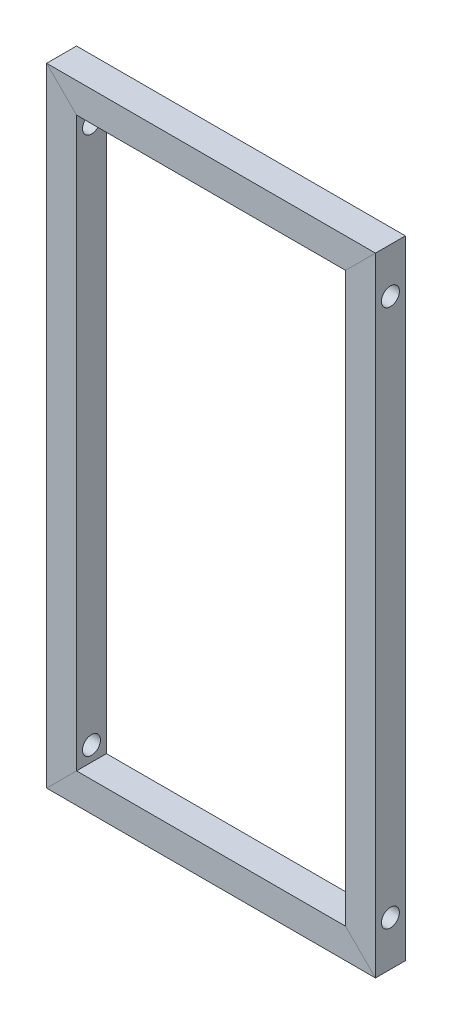
from build123d import *

# Parameters (mm, degrees)
SKETCH1_W          = 0.508
SKETCH1_H          = 0.508
SKETCH2_R          = 0.1524
CUT_EXTRUDE1_DEPTH = 12.821237499


with BuildPart() as part:
    # Sweep1: sweep along a curve in space
    with BuildLine() as sweep1_path:
        Line((0, 0, 0), (5.08, 0, 0))
        Line((5.08, 0, 0), (5.08, -10.16, 0))
        Line((5.08, -10.16, 0), (0, -10.16, 0))
        Line((0, -10.16, 0), (0, 0, 0))
    # Sketch1 → Sweep1 (sweep)
    with BuildSketch(Plane(origin=(0, 0, 0), x_dir=(0, 0, -1), z_dir=(1, 0, 0))):
        Rectangle(SKETCH1_W, SKETCH1_H)
    sweep(path=sweep1_path.line, transition=Transition.RIGHT)

    # Sketch2 → Cut-Extrude1 (cut, through all)
    with BuildSketch(Plane(origin=(5.334, 0, 0), x_dir=(0, 0, -1), z_dir=(1, 0, 0))):
        with Locations((0, -0.508)):
            Circle(SKETCH2_R)
    cut_extrude1 = extrude(amount=-CUT_EXTRUDE1_DEPTH, mode=Mode.SUBTRACT)

    # Mirror1: Cut-Extrude1 across plane
    add(cut_extrude1.mirror(Plane.ZX.offset(-5.08)), mode=Mode.SUBTRACT)


solid = part.part
